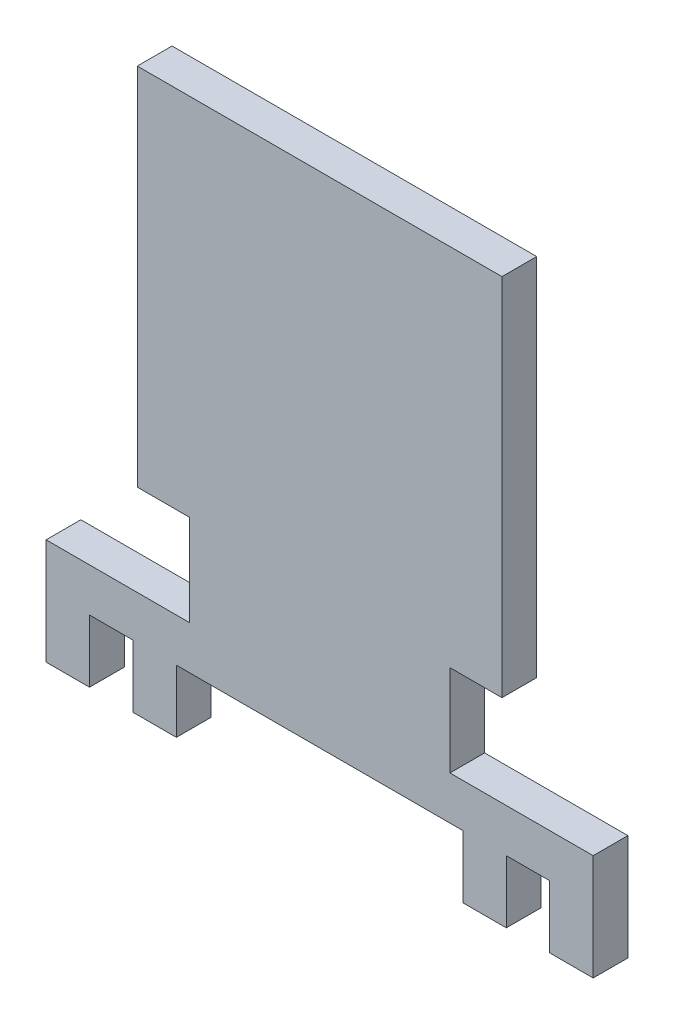
from build123d import *

# Parameters (mm, degrees)
BOSS_EXTRUDE1_DEPTH = 5.08
SKETCH2_W           = 6.35
SKETCH2_H           = 9.144
BOSS_EXTRUDE2_DEPTH = 5.08
SKETCH3_W           = 53.33
SKETCH3_H           = 53.33
MARKERBACK_DEPTH    = 5.08
SKETCH4_W           = 29.19984
SKETCH4_H           = 9.144
CUT_EXTRUDE1_DEPTH  = 5.08


with BuildPart() as part:
    # Sketch1 → Boss-Extrude1 (new body)
    with BuildSketch(Plane.XY):
        Polygon((-67.336947791, 30.441767068), (-29.236947791, 30.441767068), (-29.236947791, -9.558232932), (-8.287027791, -9.558232932), (-8.287027791, -15.908232932), (-88.286867791, -15.908232932), (-88.286867791, -9.558232932), (-67.336947791, -9.558232932), align=None)
    extrude(amount=BOSS_EXTRUDE1_DEPTH)

    # Sketch2 → Boss-Extrude2 (add)
    with BuildSketch(Plane(origin=(0, 0, 0), x_dir=(-1, 0, 0), z_dir=(0, 0, -1))):
        with Locations((85.111867791, -20.480232932)):
            Rectangle(SKETCH2_W, SKETCH2_H)
        with Locations((72.411867791, -20.480232932)):
            Rectangle(SKETCH2_W, SKETCH2_H)
        with Locations((11.462027791, -20.480232932)):
            Rectangle(SKETCH2_W, SKETCH2_H)
        with Locations((24.162027791, -20.480232932)):
            Rectangle(SKETCH2_W, SKETCH2_H)
        with Locations((59.711867791, -20.480232932)):
            Rectangle(SKETCH2_W, SKETCH2_H)
        with Locations((36.862027791, -20.480232932)):
            Rectangle(SKETCH2_W, SKETCH2_H)
    extrude(amount=-BOSS_EXTRUDE2_DEPTH)

    # Sketch3 → markerBack (add)
    with BuildSketch(Plane(origin=(0, 0, 0), x_dir=(-1, 0, 0), z_dir=(0, 0, -1))):
        with Locations((48.286947791, 30.441767068)):
            Rectangle(SKETCH3_W, SKETCH3_H)
    extrude(amount=-MARKERBACK_DEPTH)

    # Sketch4 → Cut-Extrude1 (cut)
    with BuildSketch(Plane.XY.offset(5.08)):
        with Locations((-48.286947791, -20.480232932)):
            Rectangle(SKETCH4_W, SKETCH4_H)
    extrude(amount=-CUT_EXTRUDE1_DEPTH, mode=Mode.SUBTRACT)


solid = part.part
